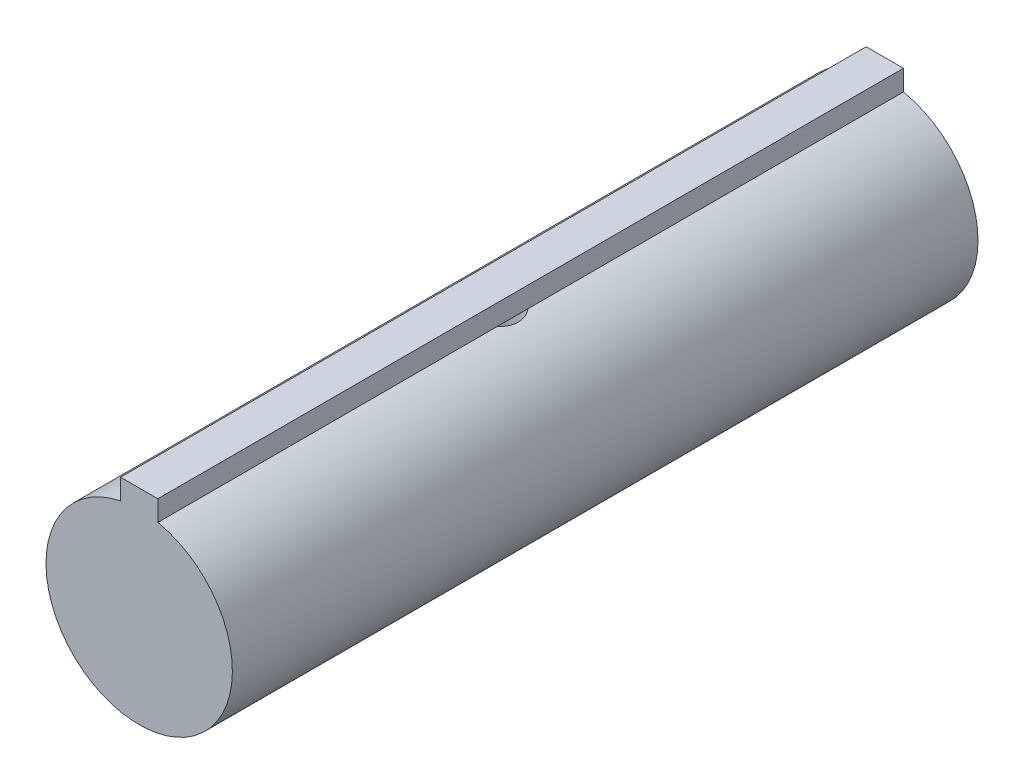
from build123d import *

# Parameters (mm, degrees)
SKETCH1_R               = 6.35
BOSS_EXTRUDE1_DEPTH     = 50.8
CUT_EXTRUDE1_DEPTH      = 52.587643869
CUT_EXTRUDE1_DEPTH_BACK = 52.587643869
SKETCH2_R               = 1.643209115
BOSS_EXTRUDE2_START     = -50.8
BOSS_EXTRUDE2_DEPTH     = 50.8


with BuildPart() as part:
    # Sketch1 → Boss-Extrude1 (new body)
    with BuildSketch(Plane.XY):
        Circle(SKETCH1_R)
    extrude(amount=BOSS_EXTRUDE1_DEPTH)

    # Sketch2 → Cut-Extrude1 (cut, two sides: drawn at the far end of the back side and taken through both)
    with BuildSketch(Plane(origin=(0, 0, 0), x_dir=(1, 0, 0), z_dir=(0, 1, 0)).offset(-CUT_EXTRUDE1_DEPTH_BACK)):
        with Locations(Location((0, -26.623855977, 0), (0, 0, 270))):
            Circle(SKETCH2_R)
    extrude(amount=CUT_EXTRUDE1_DEPTH + CUT_EXTRUDE1_DEPTH_BACK, mode=Mode.SUBTRACT)

    # Sketch4 → Boss-Extrude2 (add)
    with BuildSketch(Plane.XY.offset(50.8).offset(BOSS_EXTRUDE2_START)):
        with BuildLine():
            Line((-1.27, 6.221703947), (-1.27, 7.62))
            Line((-1.27, 7.62), (1.27, 7.62))
            Line((1.27, 7.62), (1.27, 6.221703947))
            ThreePointArc((1.27, 6.221703947), (0, 6.35), (-1.27, 6.221703947))
        make_face()
    extrude(amount=BOSS_EXTRUDE2_DEPTH)


solid = part.part
